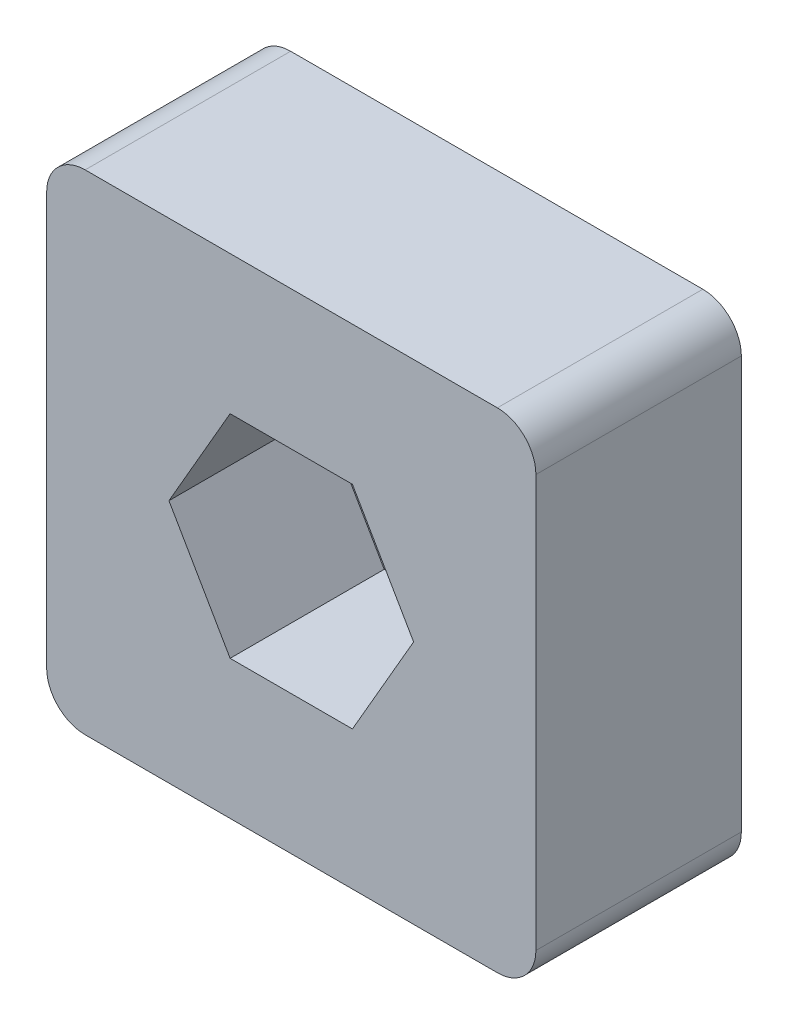
from build123d import *

# Parameters (mm, degrees)
SKETCH1_W               = 19.05
SKETCH1_H               = 19.05
BOSS_EXTRUDE1_DEPTH     = 8
SKETCH2_R               = 2.75
CUT_EXTRUDE1_DEPTH      = 6
CUT_EXTRUDE2_DEPTH      = 29.103469537
CUT_EXTRUDE2_DEPTH_BACK = 29.103469537
SKETCH2_3_R             = 2.75
FILLET1_R               = 1.5


with BuildPart() as part:
    # Sketch1 → Boss-Extrude1 (new body)
    with BuildSketch(Plane.XY):
        with Locations((9.525, 9.525)):
            Rectangle(SKETCH1_W, SKETCH1_H)
    extrude(amount=BOSS_EXTRUDE1_DEPTH)

    # Sketch2 → Cut-Extrude1 (cut)
    # profile 1 of 2: a face of its own
    with BuildSketch(Plane.XY.offset(8)):
        Polygon((7.143430137, 5.399999995), (11.906569863, 5.399999995), (14.288139727, 9.525), (11.906569863, 13.650000005), (7.143430137, 13.650000005), (4.761860273, 9.525), align=None)
        with Locations((9.525, 9.525)):
            Circle(SKETCH2_R, mode=Mode.SUBTRACT)
    # profile 2 of 2: a face of its own
    with BuildSketch(Plane.XY.offset(8)):
        with Locations((9.525, 9.525)):
            Circle(SKETCH2_R)
    extrude(amount=-CUT_EXTRUDE1_DEPTH, mode=Mode.SUBTRACT)

    # Sketch2<3> → Cut-Extrude2 (cut, two sides: drawn at the far end of the back side and taken through both)
    with BuildSketch(Plane.XY.offset(8).offset(-CUT_EXTRUDE2_DEPTH_BACK)):
        with Locations((9.525, 9.525)):
            Circle(SKETCH2_3_R)
    extrude(amount=CUT_EXTRUDE2_DEPTH + CUT_EXTRUDE2_DEPTH_BACK, mode=Mode.SUBTRACT)

    # Fillet1
    fillet1_edges = [part.edges().sort_by_distance(p)[0] for p in [
        (0, 19.05, 4),
        (19.05, 19.05, 4),
        (19.05, 0, 4),
        (0, 0, 4),
    ]]
    fillet(fillet1_edges, radius=FILLET1_R)


solid = part.part
